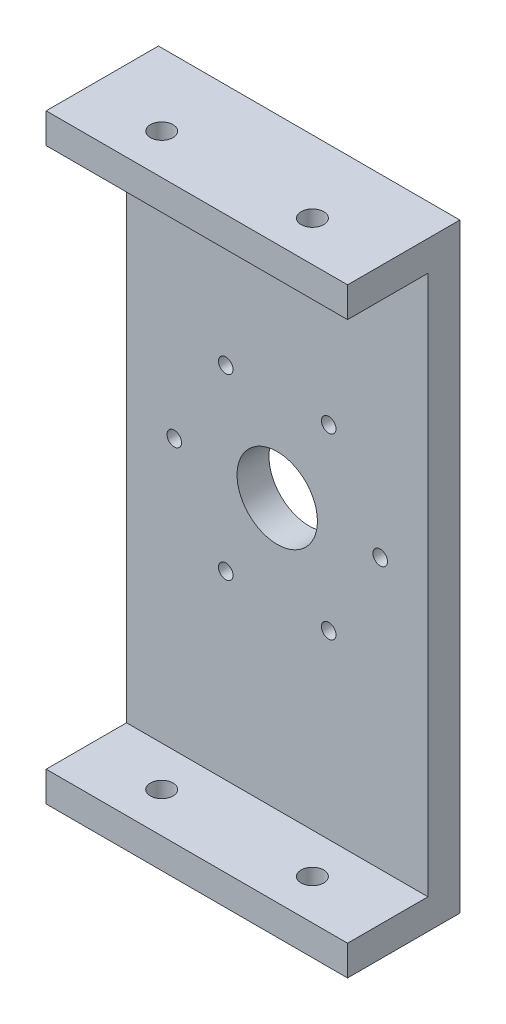
from build123d import *

# Parameters (mm, degrees)
REPISA_START                   = 372.65
SK_REPISA_W                    = 60
SK_REPISA_H                    = 119.5
REPISA_DEPTH                   = 6.35
CENTRO_MOTOR_START             = 372.65
SK_CENTRO_MOTOR_R              = 8
CENTRO_MOTOR_DEPTH             = 6.35
PASANTES_M2_5_ESTATOR_J4_START = 372.65
SK_PASANTES_M2_5_ESTATOR_J4_R  = 1.45
PASANTES_M2_5_ESTATOR_J4_DEPTH = 6.35
PESTANAS_START                 = 379
SK_PESTANAS_W                  = 60
SK_PESTANAS_H                  = 6
PESTANAS_DEPTH                 = 16
PASANTES_M4_PESTANAS_START     = -59.75
SK_PASANTES_M4_PESTANAS_R      = 2.25
PASANTES_M4_PESTANAS_DEPTH     = 119.5


with BuildPart() as part:
    # Sk_Repisa → Repisa (new body)
    with BuildSketch(Plane.XY.offset(REPISA_START)):
        Rectangle(SK_REPISA_W, SK_REPISA_H)
    extrude(amount=REPISA_DEPTH)

    # Sk_Centro_motor → Centro_motor (cut)
    with BuildSketch(Plane.XY.offset(CENTRO_MOTOR_START)):
        Circle(SK_CENTRO_MOTOR_R)
    extrude(amount=CENTRO_MOTOR_DEPTH, mode=Mode.SUBTRACT)

    # Sk_Pasantes_M2-5_estator_J4 → Pasantes_M2-5_estator_J4 (cut)
    with BuildSketch(Plane.XY.offset(PASANTES_M2_5_ESTATOR_J4_START)):
        with Locations((20.5, 0)):
            Circle(SK_PASANTES_M2_5_ESTATOR_J4_R)
        with Locations((10.25, 17.753520778)):
            Circle(SK_PASANTES_M2_5_ESTATOR_J4_R)
        with Locations((-10.25, 17.753520778)):
            Circle(SK_PASANTES_M2_5_ESTATOR_J4_R)
        with Locations((-20.5, 0)):
            Circle(SK_PASANTES_M2_5_ESTATOR_J4_R)
        with Locations((-10.25, -17.753520778)):
            Circle(SK_PASANTES_M2_5_ESTATOR_J4_R)
        with Locations((10.25, -17.753520778)):
            Circle(SK_PASANTES_M2_5_ESTATOR_J4_R)
    extrude(amount=PASANTES_M2_5_ESTATOR_J4_DEPTH, mode=Mode.SUBTRACT)

    # Sk_Pestanas → Pestanas (add)
    with BuildSketch(Plane.XY.offset(PESTANAS_START)):
        with Locations((0, 56.75)):
            Rectangle(SK_PESTANAS_W, SK_PESTANAS_H)
        with Locations((0, -56.75)):
            Rectangle(SK_PESTANAS_W, SK_PESTANAS_H)
    extrude(amount=PESTANAS_DEPTH)

    # Sk_Pasantes_M4_pestanas → Pasantes_M4_pestanas (cut)
    with BuildSketch(Plane(origin=(0, 0, 0), x_dir=(1, 0, 0), z_dir=(0, 1, 0)).offset(PASANTES_M4_PESTANAS_START)):
        with Locations(Location((-15, -387, 0), (0, 0, 270))):
            Circle(SK_PASANTES_M4_PESTANAS_R)
        with Locations(Location((15, -387, 0), (0, 0, 270))):
            Circle(SK_PASANTES_M4_PESTANAS_R)
    extrude(amount=PASANTES_M4_PESTANAS_DEPTH, mode=Mode.SUBTRACT)


solid = part.part
